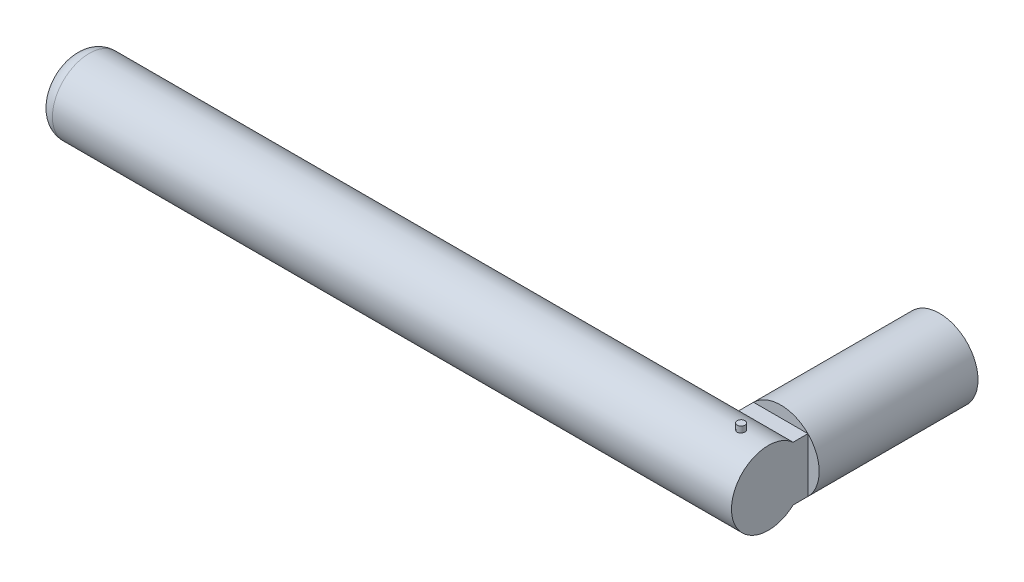
from build123d import *

# Parameters (mm, degrees)
SKETCH_1_R                  = 4.95
EXTRUDE_1_DEPTH             = 20.44
SKETCH_2_W                  = 7.000357134
SKETCH_2_H                  = 7.000357134
EXTRUDE_2_DEPTH             = 5.1
EXTRUDE_3_DEPTH             = 2
EXTRUDE_3_DEPTH_BACK        = 9.000357
EXTRUDE_4_DEPTH             = 82.4
EXTRUDE_4_DIRECTION_2_REACH = 24.791
FILLET_1_R                  = 2


with BuildPart() as part:
    # 草图1 → 凸台-拉伸1 (new body)
    with BuildSketch(Plane.XY):
        Circle(SKETCH_1_R)
    extrude(amount=-EXTRUDE_1_DEPTH)

    # 草图2 → 凸台-拉伸2 (add)
    with BuildSketch(Plane.XY):
        Rectangle(SKETCH_2_W, SKETCH_2_H)
    extrude(amount=EXTRUDE_2_DEPTH)

    # 草图3 → 凸台-拉伸3 (add, two sides: drawn at the far end of the back side and taken through both)
    with BuildSketch(Plane.XZ.offset(3.500178567).offset(-EXTRUDE_3_DEPTH_BACK)):
        with BuildLine():
            ThreePointArc((0.5, 5.1), (0, 5.6), (-0.5, 5.1))
            Line((-0.5, 5.1), (0.5, 5.1))
        make_face()
        with BuildLine():
            Line((0.5, 5.1), (-0.5, 5.1))
            ThreePointArc((-0.5, 5.1), (0, 4.6), (0.5, 5.1))
        make_face()
        with BuildLine():
            ThreePointArc((0.5, 5.1), (0, 5.6), (-0.5, 5.1))
            Line((-0.5, 5.1), (0.5, 5.1))
        make_face()
        with BuildLine():
            Line((0.5, 5.1), (-0.5, 5.1))
            ThreePointArc((-0.5, 5.1), (0, 4.6), (0.5, 5.1))
        make_face()
    extrude(amount=EXTRUDE_3_DEPTH + EXTRUDE_3_DEPTH_BACK)

    # 草图5 → 凸台-拉伸4 (add)
    with BuildSketch(Plane.ZY.offset(3.500178567)):
        with BuildLine():
            ThreePointArc((9.835, 0), (7.013225527, 4.331257679), (1.911116967, 3.500178567))
            Line((1.911116967, 3.500178567), (5.1, 3.500178567))
            Line((5.1, 3.500178567), (5.1, -3.500178567))
            Line((5.1, -3.500178567), (1.911116967, -3.500178567))
            ThreePointArc((1.911116967, -3.500178567), (7.013225527, -4.331257679), (9.835, 0))
        make_face()
        with BuildLine():
            Line((5.1, 3.500178567), (1.911116967, 3.500178567))
            ThreePointArc((1.911116967, 3.500178567), (0.365, 0), (1.911116967, -3.500178567))
            Line((1.911116967, -3.500178567), (5.1, -3.500178567))
            Line((5.1, -3.500178567), (5.1, 3.500178567))
        make_face()
        with BuildLine():
            ThreePointArc((9.835, 0), (7.013225527, 4.331257679), (1.911116967, 3.500178567))
            Line((1.911116967, 3.500178567), (5.1, 3.500178567))
            Line((5.1, 3.500178567), (5.1, -3.500178567))
            Line((5.1, -3.500178567), (1.911116967, -3.500178567))
            ThreePointArc((1.911116967, -3.500178567), (7.013225527, -4.331257679), (9.835, 0))
        make_face()
        with BuildLine():
            Line((5.1, 3.500178567), (1.911116967, 3.500178567))
            ThreePointArc((1.911116967, 3.500178567), (0.365, 0), (1.911116967, -3.500178567))
            Line((1.911116967, -3.500178567), (5.1, -3.500178567))
            Line((5.1, -3.500178567), (5.1, 3.500178567))
        make_face()
    extrude(amount=EXTRUDE_4_DEPTH)

    # 凸台-拉伸4 direction 2: up to this face of the body (flat: up to its plane)
    extrude_4_direction_2_end = Plane(part.part.faces().sort_by_distance((3.500178567, 0, 2.55))[0])
    # 草图5 → 凸台-拉伸4 direction 2 (add, up to the picked face)
    with BuildSketch(Plane.ZY.offset(3.500178567), mode=Mode.PRIVATE) as extrude_4_direction_2_sk1:
        with BuildLine():
            ThreePointArc((9.835, 0), (7.013225527, 4.331257679), (1.911116967, 3.500178567))
            Line((1.911116967, 3.500178567), (5.1, 3.500178567))
            Line((5.1, 3.500178567), (5.1, -3.500178567))
            Line((5.1, -3.500178567), (1.911116967, -3.500178567))
            ThreePointArc((1.911116967, -3.500178567), (7.013225527, -4.331257679), (9.835, 0))
        make_face()
    extrude_4_direction_2_tool1 = split(extrude(extrude_4_direction_2_sk1.sketch, amount=-EXTRUDE_4_DIRECTION_2_REACH, mode=Mode.PRIVATE), bisect_by=extrude_4_direction_2_end, keep=Keep.BOTH, mode=Mode.PRIVATE)
    # 草图5 → 凸台-拉伸4 direction 2 (add, up to the picked face)
    with BuildSketch(Plane.ZY.offset(3.500178567), mode=Mode.PRIVATE) as extrude_4_direction_2_sk2:
        with BuildLine():
            Line((5.1, 3.500178567), (1.911116967, 3.500178567))
            ThreePointArc((1.911116967, 3.500178567), (0.365, 0), (1.911116967, -3.500178567))
            Line((1.911116967, -3.500178567), (5.1, -3.500178567))
            Line((5.1, -3.500178567), (5.1, 3.500178567))
        make_face()
    extrude_4_direction_2_tool2 = split(extrude(extrude_4_direction_2_sk2.sketch, amount=-EXTRUDE_4_DIRECTION_2_REACH, mode=Mode.PRIVATE), bisect_by=extrude_4_direction_2_end, keep=Keep.BOTH, mode=Mode.PRIVATE)
    # 草图5 → 凸台-拉伸4 direction 2 (add, up to the picked face)
    with BuildSketch(Plane.ZY.offset(3.500178567), mode=Mode.PRIVATE) as extrude_4_direction_2_sk3:
        with BuildLine():
            ThreePointArc((9.835, 0), (7.013225527, 4.331257679), (1.911116967, 3.500178567))
            Line((1.911116967, 3.500178567), (5.1, 3.500178567))
            Line((5.1, 3.500178567), (5.1, -3.500178567))
            Line((5.1, -3.500178567), (1.911116967, -3.500178567))
            ThreePointArc((1.911116967, -3.500178567), (7.013225527, -4.331257679), (9.835, 0))
        make_face()
    extrude_4_direction_2_tool3 = split(extrude(extrude_4_direction_2_sk3.sketch, amount=-EXTRUDE_4_DIRECTION_2_REACH, mode=Mode.PRIVATE), bisect_by=extrude_4_direction_2_end, keep=Keep.BOTH, mode=Mode.PRIVATE)
    # 草图5 → 凸台-拉伸4 direction 2 (add, up to the picked face)
    with BuildSketch(Plane.ZY.offset(3.500178567), mode=Mode.PRIVATE) as extrude_4_direction_2_sk4:
        with BuildLine():
            Line((5.1, 3.500178567), (1.911116967, 3.500178567))
            ThreePointArc((1.911116967, 3.500178567), (0.365, 0), (1.911116967, -3.500178567))
            Line((1.911116967, -3.500178567), (5.1, -3.500178567))
            Line((5.1, -3.500178567), (5.1, 3.500178567))
        make_face()
    extrude_4_direction_2_tool4 = split(extrude(extrude_4_direction_2_sk4.sketch, amount=-EXTRUDE_4_DIRECTION_2_REACH, mode=Mode.PRIVATE), bisect_by=extrude_4_direction_2_end, keep=Keep.BOTH, mode=Mode.PRIVATE)
    add(extrude_4_direction_2_tool1.solids().sort_by(Axis((-3.500179, 0, 6.679951), (1, 0, 0)))[0])
    add(extrude_4_direction_2_tool2.solids().sort_by(Axis((-3.500179, 0, 2.947224), (1, 0, 0)))[0])
    add(extrude_4_direction_2_tool3.solids().sort_by(Axis((-3.500179, 0, 6.679951), (1, 0, 0)))[0])
    add(extrude_4_direction_2_tool4.solids().sort_by(Axis((-3.500179, 0, 2.947224), (1, 0, 0)))[0])

    # 圆角1
    fillet_1_edges = [part.edges().sort_by_distance(p)[0] for p in [
        (-85.900178567, -3.500178567, 8.288883033),
    ]]
    fillet(fillet_1_edges, radius=FILLET_1_R)


solid = part.part
